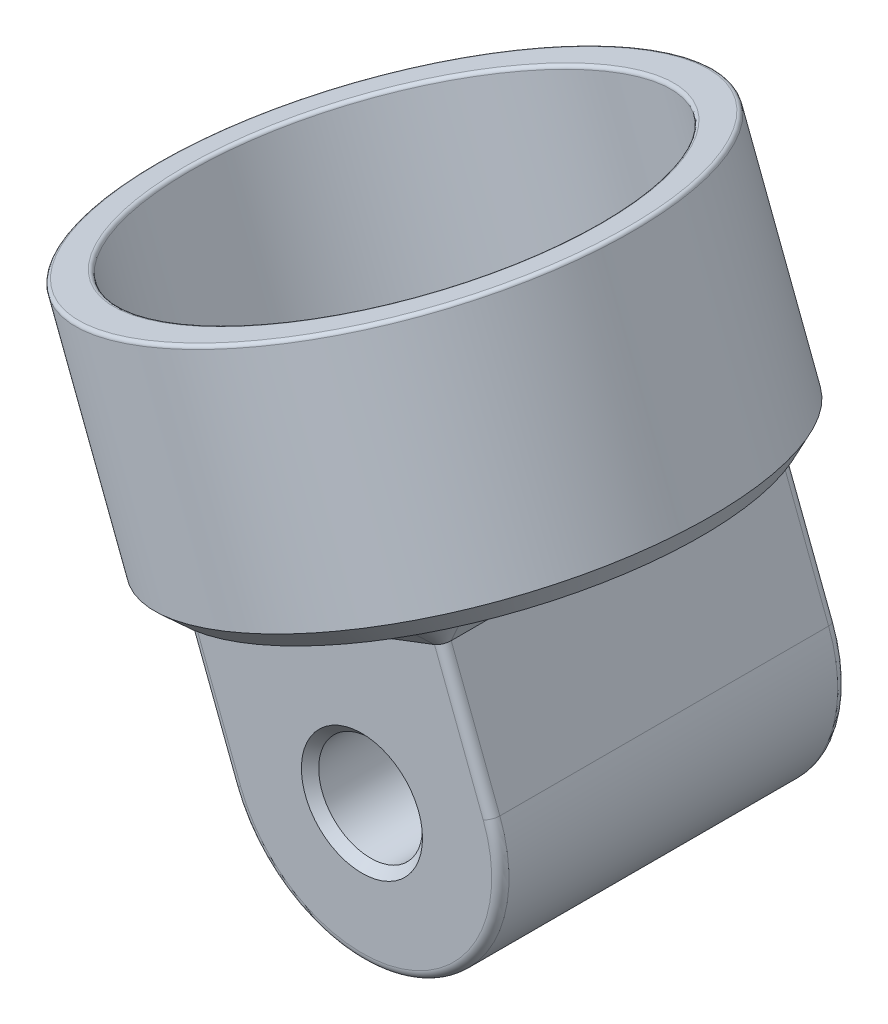
from build123d import *

# Parameters (mm, degrees)
BOSS_EXTRUDE1_DEPTH      = 10
BOSS_EXTRUDE1_DEPTH_BACK = 10
SKETCH2_R                = 3
BOSS_EXTRUDE2_DEPTH      = 1.5
BOSS_EXTRUDE2_DEPTH_BACK = 2.5
SKETCH3_R                = 15.7
BOSS_EXTRUDE4_START      = 10
SKETCH4_R                = 15.7
SKETCH4_R_2              = 12.7
BOSS_EXTRUDE4_DEPTH      = 10
FILLET6_R                = 0.5
CHAMFER1_SIZE            = 0.5
SKETCH5_R                = 19.89902312
SKETCH5_R_2              = 14.7
CUT_EXTRUDE2_DEPTH       = 135.083701085
FILLET7_R                = 0.2
CHAMFER3_SIZE            = 1


with BuildPart() as part:
    # Sketch2 → Boss-Extrude1 (new, two sides: drawn at the far end of the back side and taken through both)
    with BuildSketch(Plane.XY.offset(-BOSS_EXTRUDE1_DEPTH_BACK)):
        with BuildLine():
            Line((94.051269644, 47.422261979), (89.989154813, 58.054980417))
            Line((89.989154813, 58.054980417), (104.935548085, 63.765087962))
            Line((104.935548085, 63.765087962), (108.997662915, 53.132369524))
            ThreePointArc((108.997662915, 53.132369524), (104.379520052, 42.804119115), (94.051269644, 47.422261979))
        make_face()
        with Locations((101.52446628, 50.277315751)):
            Circle(SKETCH2_R, mode=Mode.SUBTRACT)
    extrude(amount=BOSS_EXTRUDE1_DEPTH + BOSS_EXTRUDE1_DEPTH_BACK)

    # Sketch3 → Boss-Extrude2 (add, two sides: drawn at the far end of the back side and taken through both)
    with BuildSketch(Plane(origin=(-7.892992814, 20.660166865, 0), x_dir=(0.9341495794706384, 0.3568817215476715, 0), z_dir=(-0.3568817215476715, 0.9341495794706384, 0)).offset(-BOSS_EXTRUDE2_DEPTH_BACK)):
        with Locations((112.782092481, 0)):
            Circle(SKETCH3_R)
    extrude(amount=BOSS_EXTRUDE2_DEPTH + BOSS_EXTRUDE2_DEPTH_BACK)

    # Sketch4 → Boss-Extrude4 (add)
    with BuildSketch(Plane(origin=(-8.428315397, 22.061391234, 0), x_dir=(0.9341495794706381, 0.3568817215476716, 0), z_dir=(-0.3568817215476716, 0.9341495794706383, 0)).offset(BOSS_EXTRUDE4_START)):
        with Locations((112.782092481, 0)):
            Circle(SKETCH4_R)
        with Locations((112.782092481, 0)):
            Circle(SKETCH4_R_2, mode=Mode.SUBTRACT)
    extrude(amount=-BOSS_EXTRUDE4_DEPTH)

    # Fillet6
    fillet6_edges = [part.edges().sort_by_distance(p)[0] for p in [
        (107.412707652, 57.281041768, -10),
        (104.379520052, 42.804119115, -10),
        (92.46631438, 51.570934224, -10),
        (107.412707652, 57.281041768, 10),
        (104.379520052, 42.804119115, 10),
        (92.46631438, 51.570934224, 10),
    ]]
    fillet(fillet6_edges, radius=FILLET6_R)

    # Chamfer1
    chamfer1_edges = [part.edges().sort_by_distance(p)[0] for p in [
        (98.52446628, 50.277315751, 10),
        (98.52446628, 50.277315751, -10),
    ]]
    chamfer(chamfer1_edges, length=CHAMFER1_SIZE)

    # Sketch5 → Cut-Extrude2 (cut, through all)
    with BuildSketch(Plane(origin=(-11.997132612, 31.402887029, 0), x_dir=(0.9341495794706383, 0.35688172154767156, 0), z_dir=(-0.35688172154767156, 0.9341495794706383, 0))):
        with Locations((112.782092481, 0)):
            Circle(SKETCH5_R)
        with Locations((112.782092481, 0)):
            Circle(SKETCH5_R_2, mode=Mode.SUBTRACT)
    extrude(amount=-CUT_EXTRUDE2_DEPTH, mode=Mode.SUBTRACT)

    # Fillet7
    fillet7_edges = [part.edges().sort_by_distance(p)[0] for p in [
        (79.626212833, 66.406593047, 0),
        (81.494511992, 67.12035649, 0),
    ]]
    fillet(fillet7_edges, radius=FILLET7_R)

    # Chamfer3
    chamfer3_edges = [part.edges().sort_by_distance(p)[0] for p in [
        (84.622556934, 53.328498934, 0),
        (105.69094935, 61.377449895, 9.853553391),
        (98.354555753, 58.574660241, 10),
        (91.018162155, 55.771870587, 9.853553391),
        (90.881359117, 55.719606469, 0),
        (91.018162155, 55.771870587, -9.853553391),
        (98.354555753, 58.574660241, -10),
        (105.69094935, 61.377449895, -9.853553391),
        (105.827752388, 61.429714013, 0),
    ]]
    chamfer(chamfer3_edges, length=CHAMFER3_SIZE)


solid = part.part
